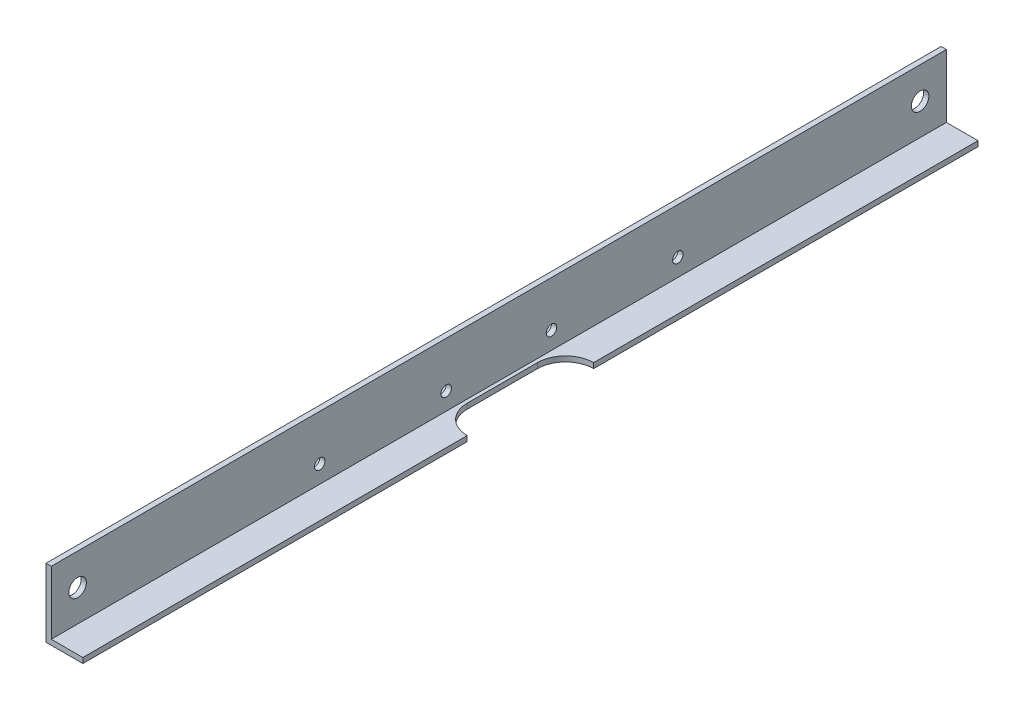
from build123d import *

# Parameters (mm, degrees)
ESQUISSE1_W             = 19.5
ESQUISSE1_H             = 1.5
EXTRU_MINCE1_DEPTH      = 127.5
ESQUISSE2_W             = 1.5
ESQUISSE2_H             = 19.5
EXTRU_MINCE2_DEPTH      = 255
ENL_V_MAT_EXTRU_1_DEPTH = 130.132925701
ESQUISSE4_R             = 2.5
ENL_V_MAT_EXTRU_2_DEPTH = 130.409234601
ESQUISSE5_R             = 1.5
ENL_V_MAT_EXTRU_3_DEPTH = 130.350541166
ESQUISSE6_R             = 1.5
ENL_V_MAT_EXTRU_4_DEPTH = 130.409234601


with BuildPart() as part:
    # Esquisse1 → Extru.-Mince1 (new, symmetric)
    with BuildSketch(Plane.XY):
        with Locations((0, 0.75)):
            Rectangle(ESQUISSE1_W, ESQUISSE1_H)
    extrude(amount=EXTRU_MINCE1_DEPTH, both=True)

    # Esquisse2 → Extru.-Mince2 (add)
    with BuildSketch(Plane(origin=(0, 0, -127.5), x_dir=(-1, 0, 0), z_dir=(0, 0, -1))):
        with Locations((0, 9.75)):
            Rectangle(ESQUISSE2_W, ESQUISSE2_H)
    extrude(amount=-EXTRU_MINCE2_DEPTH)

    # Esquisse3 → Enlèv. mat.-Extru.1 (cut, through all)
    with BuildSketch(Plane(origin=(0, 1.5, 0), x_dir=(1, 0, 0), z_dir=(0, 1, 0))):
        with BuildLine():
            Line((-0.75, 127.5), (-0.75, 110))
            ThreePointArc((-0.75, 110), (-8.75, 102), (-16.75, 110))
            Line((-16.75, 110), (-16.75, 127.5))
            ThreePointArc((-16.75, 127.5), (-8.75, 135.5), (-0.75, 127.5))
        make_face()
        with BuildLine():
            Line((17.75, 10), (17.75, -10))
            ThreePointArc((17.75, -10), (9.75, -18), (1.75, -10))
            Line((1.75, -10), (1.75, 10))
            ThreePointArc((1.75, 10), (9.75, 18), (17.75, 10))
        make_face()
        with BuildLine():
            Line((-16.75, -127.5), (-16.75, -110))
            ThreePointArc((-16.75, -110), (-8.75, -102), (-0.75, -110))
            Line((-0.75, -110), (-0.75, -127.5))
            ThreePointArc((-0.75, -127.5), (-8.75, -135.5), (-16.75, -127.5))
        make_face()
    extrude(amount=-ENL_V_MAT_EXTRU_1_DEPTH, mode=Mode.SUBTRACT)

    # Esquisse4 → Enlèv. mat.-Extru.2 (cut, through all)
    with BuildSketch(Plane(origin=(0.75, 0, 0), x_dir=(0, 0, -1), z_dir=(1, 0, 0))):
        with Locations((-120, 10.5)):
            Circle(ESQUISSE4_R)
        with Locations((120, 10.5)):
            Circle(ESQUISSE4_R)
    extrude(amount=-ENL_V_MAT_EXTRU_2_DEPTH, mode=Mode.SUBTRACT)

    # Esquisse5 → Enlèv. mat.-Extru.3 (cut, through all)
    with BuildSketch(Plane.XZ):
        with Locations(Location((-5.75, 59, 0), (0, 0, 270))):
            Circle(ESQUISSE5_R)
        with Locations(Location((-5.75, -59, 0), (0, 0, 90))):
            Circle(ESQUISSE5_R)
    extrude(amount=-ENL_V_MAT_EXTRU_3_DEPTH, mode=Mode.SUBTRACT)

    # Esquisse6 → Enlèv. mat.-Extru.4 (cut, through all)
    with BuildSketch(Plane(origin=(0.75, 0, 0), x_dir=(0, 0, -1), z_dir=(1, 0, 0))):
        with Locations((-51, 6.5)):
            Circle(ESQUISSE6_R)
        with Locations((-15, 6.5)):
            Circle(ESQUISSE6_R)
        with Locations((15, 6.5)):
            Circle(ESQUISSE6_R)
        with Locations((51, 6.5)):
            Circle(ESQUISSE6_R)
    extrude(amount=-ENL_V_MAT_EXTRU_4_DEPTH, mode=Mode.SUBTRACT)


solid = part.part
